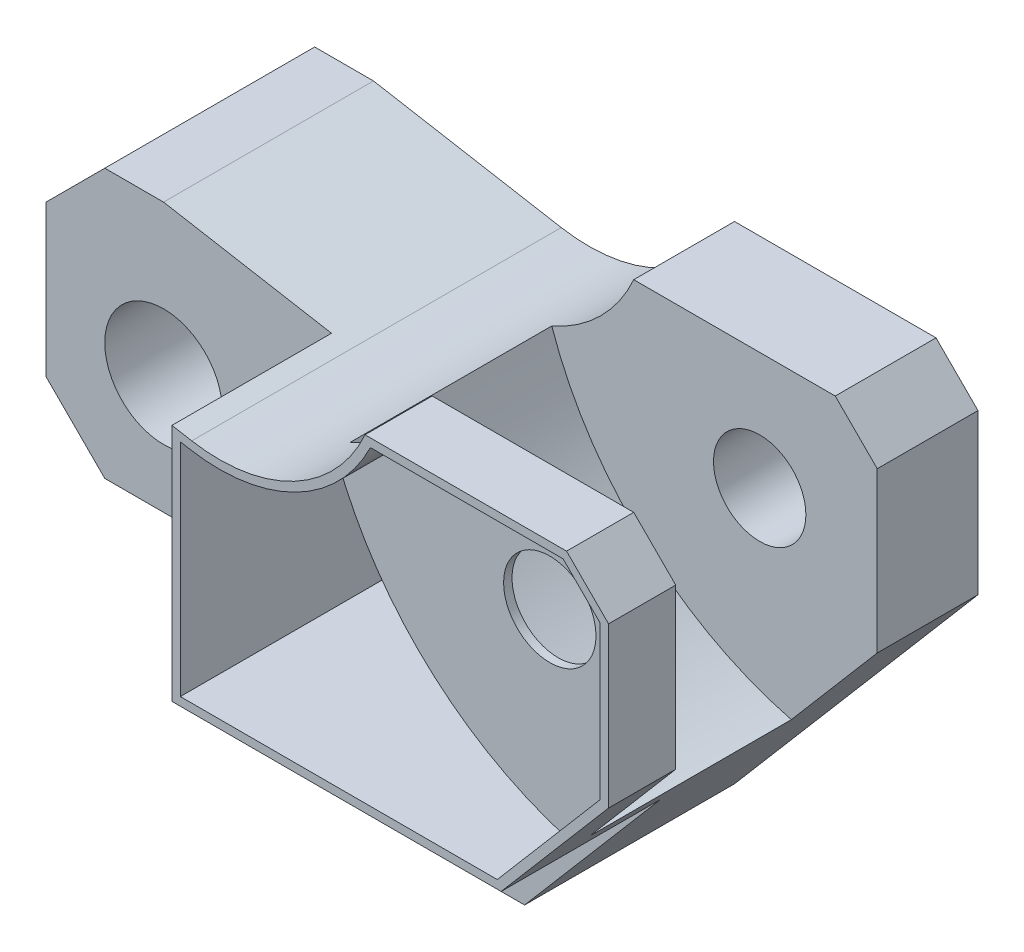
from build123d import *

# Parameters (mm, degrees)
SKETCH1_R           = 7
BOSS_EXTRUDE1_DEPTH = 44
SKETCH3_R           = 41
CUT_EXTRUDE1_DEPTH  = 24
SKETCH4_W           = 19
SKETCH4_H           = 19
CUT_EXTRUDE2_DEPTH  = 105.177732746
SKETCH5_W           = 34
SKETCH5_H           = 32
CUT_EXTRUDE4_DEPTH  = 19
SKETCH6_R           = 5.5
CUT_EXTRUDE5_DEPTH  = 105.177732746
CUT_EXTRUDE6_DEPTH  = 7
CUT_EXTRUDE11_DEPTH = 25


with BuildPart() as part:
    # Sketch1 → Boss-Extrude1 (new body)
    with BuildSketch(Plane.XY):
        with BuildLine():
            Line((0, 7), (0, 25))
            Line((0, 25), (7, 32))
            Line((7, 32), (14, 32))
            Line((14, 32), (36.361380836, 28.057085233))
            ThreePointArc((36.361380836, 28.057085233), (48.561098706, 29.982044142), (57, 39))
            Line((57, 39), (81, 39))
            Line((81, 39), (86, 34))
            Line((86, 34), (86, 15))
            Line((86, 15), (57, -19))
            Line((57, -19), (51.296980053, -19))
            ThreePointArc((51.296980053, -19), (46.858007856, -12.115672061), (44.521177653, -4.264705882))
            ThreePointArc((44.521177653, -4.264705882), (42.840774692, -1.213413768), (39.575538911, 0))
            Line((39.575538911, 0), (7, 0))
            Line((7, 0), (0, 7))
        make_face()
        with Locations((14, 14)):
            Circle(SKETCH1_R, mode=Mode.SUBTRACT)
    extrude(amount=BOSS_EXTRUDE1_DEPTH)

    # Sketch3 → Cut-Extrude1 (cut)
    with BuildSketch(Plane(origin=(0, 0, 12), x_dir=(-1, 0, 0), z_dir=(0, 0, -1))):
        with Locations((-86, 42.701873436)):
            Circle(SKETCH3_R)
    extrude(amount=-CUT_EXTRUDE1_DEPTH, mode=Mode.SUBTRACT)

    # Sketch4 → Cut-Extrude2 (cut, through all)
    with BuildSketch(Plane(origin=(86, 0, 0), x_dir=(0, 0, -1), z_dir=(1, 0, 0))):
        with Locations((-34.5, -9.5)):
            Rectangle(SKETCH4_W, SKETCH4_H)
    extrude(amount=-CUT_EXTRUDE2_DEPTH, mode=Mode.SUBTRACT)

    # Sketch5 → Cut-Extrude4 (cut)
    with BuildSketch(Plane.XY.offset(44)):
        with Locations((17, 16)):
            Rectangle(SKETCH5_W, SKETCH5_H)
    extrude(amount=-CUT_EXTRUDE4_DEPTH, mode=Mode.SUBTRACT)

    # Sketch6 → Cut-Extrude5 (cut, through all)
    with BuildSketch(Plane.XY.offset(44)):
        with Locations((72, 25)):
            Circle(SKETCH6_R)
    extrude(amount=-CUT_EXTRUDE5_DEPTH, mode=Mode.SUBTRACT)

    # Sketch8 → Cut-Extrude6 (cut)
    with BuildSketch(Plane.XY.offset(44)):
        with BuildLine():
            Line((35, 27.281706793), (35, 1))
            Line((35, 1), (72.744476296, 1))
            Line((72.744476296, 1), (85, 15.368545033))
            Line((85, 15.368545033), (85, 33.585786438))
            Line((85, 33.585786438), (80.585786438, 38))
            Line((80.585786438, 38), (57.636084685, 38))
            ThreePointArc((57.636084685, 38), (48.740005768, 28.948047079), (36.187732658, 27.07227748))
            Line((36.187732658, 27.07227748), (35, 27.281706793))
        make_face()
    extrude(amount=-CUT_EXTRUDE6_DEPTH, mode=Mode.SUBTRACT)

    # Sketch9 → Cut-Extrude11 (cut)
    with BuildSketch(Plane.XY.offset(37)):
        with BuildLine():
            ThreePointArc((46.646682943, 28.028208705), (41.481076416, 26.851449437), (36.187732658, 27.07227748))
            Line((36.187732658, 27.07227748), (35, 27.281706793))
            Line((35, 27.281706793), (35, 1))
            Line((35, 1), (72.744476296, 1))
            Line((72.744476296, 1), (73.986847747, 2.456573425))
            ThreePointArc((73.986847747, 2.456573425), (57.310181683, 12.027872638), (46.646682943, 28.028208705))
        make_face()
    extrude(amount=-CUT_EXTRUDE11_DEPTH, mode=Mode.SUBTRACT)


solid = part.part
